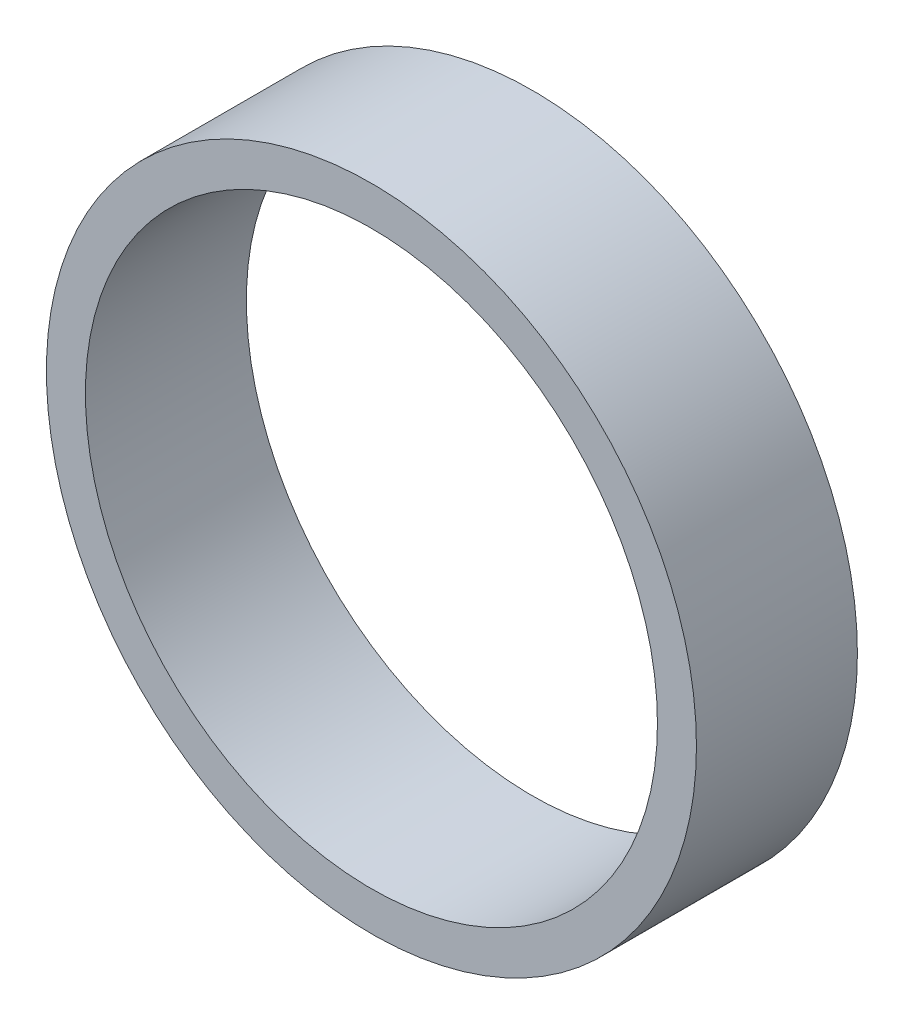
from build123d import *

# Parameters (mm, degrees)
SKETCH1_R           = 25
SKETCH1_R_2         = 22
BOSS_EXTRUDE1_DEPTH = 12.38


with BuildPart() as part:
    # Sketch1 → Boss-Extrude1 (new body)
    with BuildSketch(Plane.XY):
        Circle(SKETCH1_R)
        Circle(SKETCH1_R_2, mode=Mode.SUBTRACT)
    extrude(amount=-BOSS_EXTRUDE1_DEPTH)


solid = part.part
